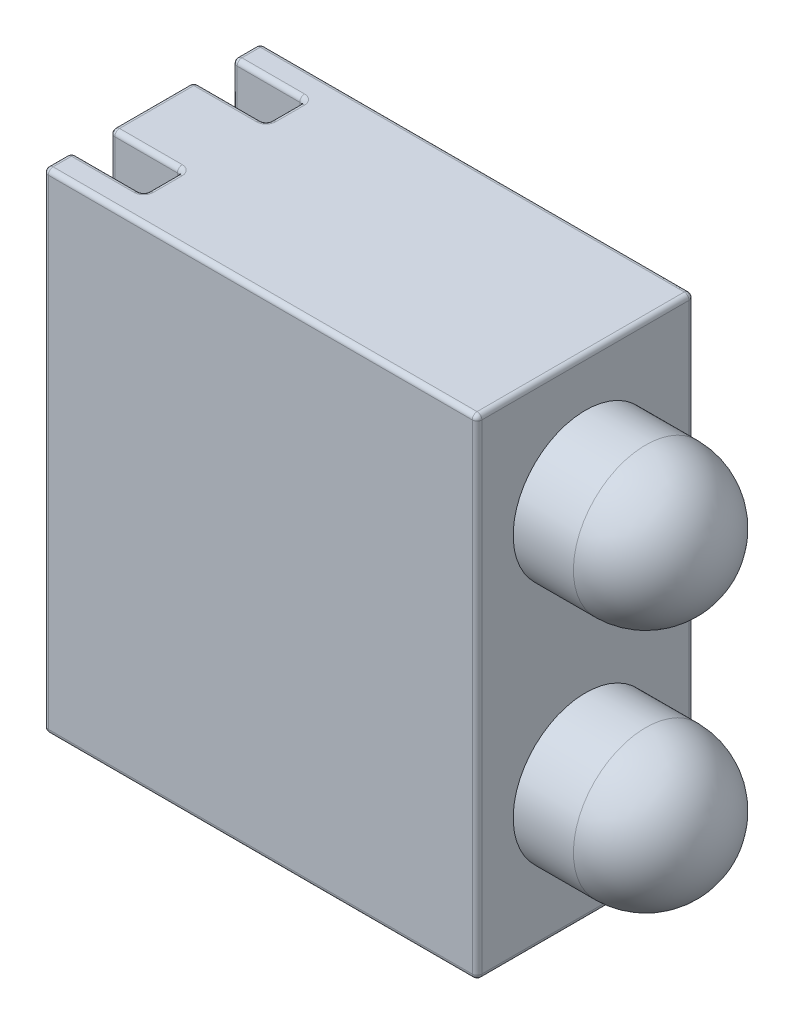
from build123d import *

# Parameters (mm, degrees)
SKETCH1_W           = 9
SKETCH1_H           = 10.16
BOSS_EXTRUDE1_DEPTH = 2.25
SKETCH2_W           = 0.8
SKETCH2_H           = 10.16
CUT_EXTRUDE1_DEPTH  = 1.5
LPATTERN1_COUNT     = 2
LPATTERN1_PITCH     = 5.08
FILLET1_R           = 0.1


with BuildPart() as part:
    # Sketch1 → Boss-Extrude1 (new, symmetric)
    with BuildSketch(Plane.XY):
        with Locations((4.5, 5.08)):
            Rectangle(SKETCH1_W, SKETCH1_H)
    extrude(amount=BOSS_EXTRUDE1_DEPTH, both=True)

    # Sketch2 → Cut-Extrude1 (cut)
    with BuildSketch(Plane.ZY):
        with Locations((-1.27, 5.08)):
            Rectangle(SKETCH2_W, SKETCH2_H)
        with Locations((1.27, 5.08)):
            Rectangle(SKETCH2_W, SKETCH2_H)
    extrude(amount=-CUT_EXTRUDE1_DEPTH, mode=Mode.SUBTRACT)

    # Sketch3 → Revolve4 (revolve)
    with BuildSketch(Plane.XY, mode=Mode.PRIVATE) as revolve4_sk:
        with BuildLine():
            Line((10.25, 9.16), (9, 9.16))
            Line((9, 9.16), (9, 7.66))
            Line((9, 7.66), (11.75, 7.66))
            ThreePointArc((11.75, 7.66), (11.310660172, 8.720660172), (10.25, 9.16))
        make_face()
    revolve4 = revolve(revolve4_sk.sketch.rotate(Axis((11.75, 7.66, 0), (-1, 0, 0)), 180), axis=Axis((11.75, 7.66, 0), (-1, 0, 0)))

    # LPattern1: Revolve4 ×2
    with Locations(*[(0, -i * LPATTERN1_PITCH, 0) for i in range(1, LPATTERN1_COUNT)]):
        add(revolve4)

    # Fillet1
    fillet1_edges = [part.edges().sort_by_distance(p)[0] for p in [
        (9, 5.08, 2.25),
        (4.5, 10.16, 2.25),
        (0, 10.16, 0),
        (0, 10.16, -1.96),
        (0, 0, 0),
        (0, 0, -1.96),
        (1.5, 5.08, -0.87),
        (0.75, 10.16, -0.87),
        (1.5, 0, -1.27),
        (0.75, 0, -0.87),
        (1.5, 5.08, -1.67),
        (0.75, 0, -1.67),
        (1.5, 10.16, -1.27),
        (0.75, 10.16, -1.67),
        (0, 5.08, -0.87),
        (0, 5.08, -1.67),
        (1.5, 5.08, 1.67),
        (0.75, 10.16, 1.67),
        (1.5, 0, 1.27),
        (0.75, 0, 1.67),
        (1.5, 5.08, 0.87),
        (0.75, 0, 0.87),
        (1.5, 10.16, 1.27),
        (0.75, 10.16, 0.87),
        (0, 5.08, 1.67),
        (0, 5.08, 0.87),
        (0, 5.08, 2.25),
        (4.5, 10.16, -2.25),
        (9, 5.08, -2.25),
        (4.5, 0, -2.25),
        (0, 5.08, -2.25),
        (4.5, 0, 2.25),
        (0, 10.16, 1.96),
        (9, 10.16, 0),
        (9, 0, 0),
        (0, 0, 1.96),
    ]]
    fillet(fillet1_edges, radius=FILLET1_R)


solid = part.part
